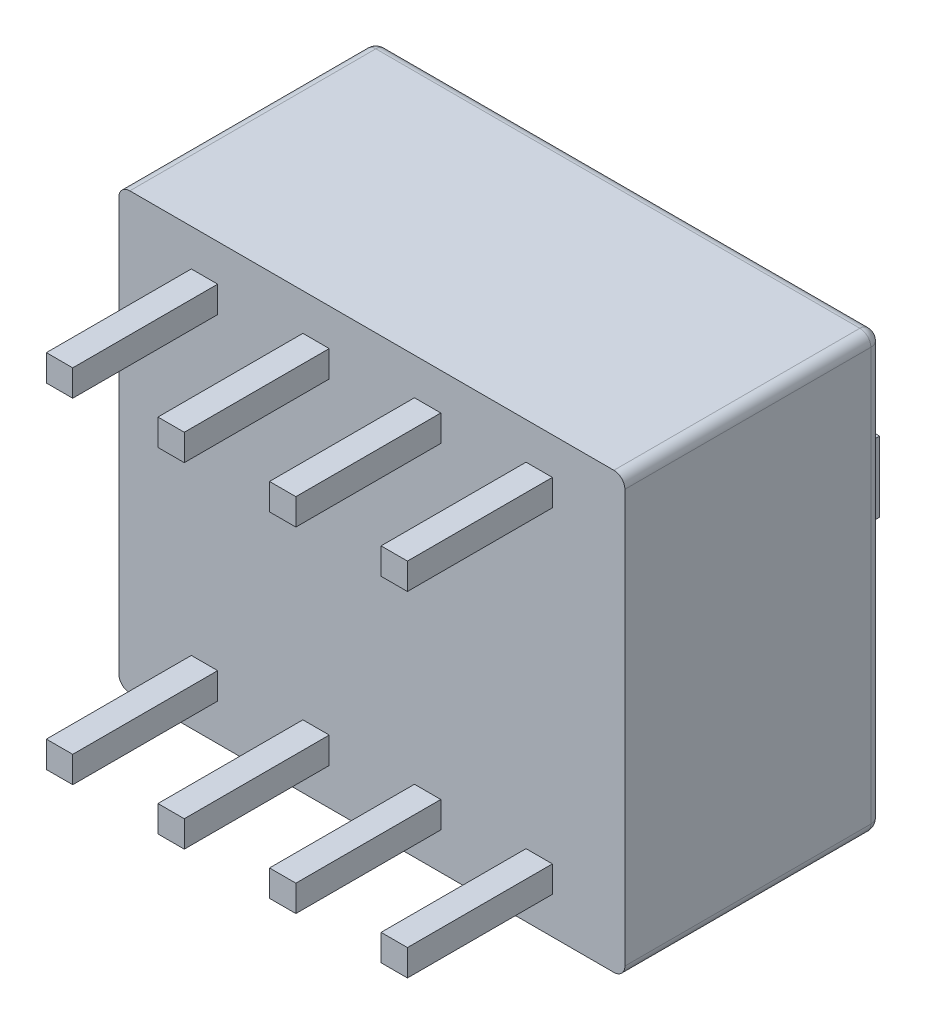
from build123d import *

# Parameters (mm, degrees)
IZIM1_W                       = 11.52
IZIM1_H                       = 9.9
Y_KSEKLIK_EKSTR_ZYON1_DEPTH   = 5.85
IZIM2_W                       = 1.4
IZIM2_H                       = 3.2
KES_EKSTR_ZYON1_DEPTH         = 1
IZIM4_W                       = 1.4
IZIM4_H                       = 1.6
Y_KSEKLIK_EKSTR_ZYON2_DEPTH   = 2.2
Y_KSEKLIK_EKSTR_ZYON2_2_DEPTH = 2.2
Y_KSEKLIK_EKSTR_ZYON2_3_DEPTH = 2.2
Y_KSEKLIK_EKSTR_ZYON2_4_DEPTH = 2.2
IZIM5_W                       = 1.4
IZIM5_H                       = 1.6
Y_KSEKLIK_EKSTR_ZYON3_DEPTH   = 0.9
Y_KSEKLIK_EKSTR_ZYON3_2_DEPTH = 0.9
Y_KSEKLIK_EKSTR_ZYON3_3_DEPTH = 0.9
Y_KSEKLIK_EKSTR_ZYON3_4_DEPTH = 0.9
RADYUS1_R                     = 0.25
IZIM6_W                       = 0.6
IZIM6_H                       = 0.6
Y_KSEKLIK_EKSTR_ZYON4_DEPTH   = 3.3


with BuildPart() as part:
    # Çizim1 → Yükseklik-Ekstrüzyon1 (new body)
    with BuildSketch(Plane.XY):
        Rectangle(IZIM1_W, IZIM1_H)
    extrude(amount=Y_KSEKLIK_EKSTR_ZYON1_DEPTH)

    # Çizim2 → Kes-Ekstrüzyon1 (cut)
    with BuildSketch(Plane(origin=(0, 0, 0), x_dir=(-1, 0, 0), z_dir=(0, 0, -1))):
        with Locations((3.81, 0)):
            Rectangle(IZIM2_W, IZIM2_H)
        with Locations((1.27, 0)):
            Rectangle(IZIM2_W, IZIM2_H)
        with Locations((-1.27, 0)):
            Rectangle(IZIM2_W, IZIM2_H)
        with Locations((-3.81, 0)):
            Rectangle(IZIM2_W, IZIM2_H)
    extrude(amount=-KES_EKSTR_ZYON1_DEPTH, mode=Mode.SUBTRACT)

    # Radyus1
    radyus1_edges = [part.edges().sort_by_distance(p)[0] for p in [
        (0, -4.95, 0),
        (-5.76, 0, 0),
        (0, 4.95, 0),
        (5.76, 0, 0),
        (5.76, -4.95, 2.925),
        (-5.76, -4.95, 2.925),
        (-5.76, 4.95, 2.925),
        (5.76, 4.95, 2.925),
    ]]
    fillet(radyus1_edges, radius=RADYUS1_R)

    # Çizim6 → Yükseklik-Ekstrüzyon4 (add)
    with BuildSketch(Plane.XY.offset(5.85)):
        with Locations((3.81, 3.81)):
            Rectangle(IZIM6_W, IZIM6_H)
        with Locations((1.27, 3.81)):
            Rectangle(IZIM6_W, IZIM6_H)
        with Locations((-1.27, 3.81)):
            Rectangle(IZIM6_W, IZIM6_H)
        with Locations((-3.81, 3.81)):
            Rectangle(IZIM6_W, IZIM6_H)
        with Locations((3.81, -3.81)):
            Rectangle(IZIM6_W, IZIM6_H)
        with Locations((1.27, -3.81)):
            Rectangle(IZIM6_W, IZIM6_H)
        with Locations((-1.27, -3.81)):
            Rectangle(IZIM6_W, IZIM6_H)
        with Locations((-3.81, -3.81)):
            Rectangle(IZIM6_W, IZIM6_H)
    extrude(amount=Y_KSEKLIK_EKSTR_ZYON4_DEPTH)


with BuildPart() as body_2:
    # Çizim4 → Yükseklik-Ekstrüzyon2 (new body)
    with BuildSketch(Plane(origin=(0, 0, 1), x_dir=(-1, 0, 0), z_dir=(0, 0, -1))):
        with Locations((3.81, 0.8)):
            Rectangle(IZIM4_W, IZIM4_H)
    extrude(amount=Y_KSEKLIK_EKSTR_ZYON2_DEPTH)


with BuildPart() as body_3:
    # Çizim4 → Y_kseklik-Ekstr_zyon2 2 (new body)
    with BuildSketch(Plane(origin=(0, 0, 1), x_dir=(-1, 0, 0), z_dir=(0, 0, -1))):
        with Locations((1.27, 0.8)):
            Rectangle(IZIM4_W, IZIM4_H)
    extrude(amount=Y_KSEKLIK_EKSTR_ZYON2_2_DEPTH)


with BuildPart() as body_4:
    # Çizim4 → Y_kseklik-Ekstr_zyon2 3 (new body)
    with BuildSketch(Plane(origin=(0, 0, 1), x_dir=(-1, 0, 0), z_dir=(0, 0, -1))):
        with Locations((-1.27, 0.8)):
            Rectangle(IZIM4_W, IZIM4_H)
    extrude(amount=Y_KSEKLIK_EKSTR_ZYON2_3_DEPTH)


with BuildPart() as body_5:
    # Çizim4 → Y_kseklik-Ekstr_zyon2 4 (new body)
    with BuildSketch(Plane(origin=(0, 0, 1), x_dir=(-1, 0, 0), z_dir=(0, 0, -1))):
        with Locations((-3.81, 0.8)):
            Rectangle(IZIM4_W, IZIM4_H)
    extrude(amount=Y_KSEKLIK_EKSTR_ZYON2_4_DEPTH)


with BuildPart() as body_6:
    # Çizim5 → Yükseklik-Ekstrüzyon3 (new body)
    with BuildSketch(Plane(origin=(0, 0, 1), x_dir=(-1, 0, 0), z_dir=(0, 0, -1))):
        with Locations((-3.81, -0.8)):
            Rectangle(IZIM5_W, IZIM5_H)
    extrude(amount=Y_KSEKLIK_EKSTR_ZYON3_DEPTH)


with BuildPart() as body_7:
    # Çizim5 → Y_kseklik-Ekstr_zyon3 2 (new body)
    with BuildSketch(Plane(origin=(0, 0, 1), x_dir=(-1, 0, 0), z_dir=(0, 0, -1))):
        with Locations((-1.27, -0.8)):
            Rectangle(IZIM5_W, IZIM5_H)
    extrude(amount=Y_KSEKLIK_EKSTR_ZYON3_2_DEPTH)


with BuildPart() as body_8:
    # Çizim5 → Y_kseklik-Ekstr_zyon3 3 (new body)
    with BuildSketch(Plane(origin=(0, 0, 1), x_dir=(-1, 0, 0), z_dir=(0, 0, -1))):
        with Locations((1.27, -0.8)):
            Rectangle(IZIM5_W, IZIM5_H)
    extrude(amount=Y_KSEKLIK_EKSTR_ZYON3_3_DEPTH)


with BuildPart() as body_9:
    # Çizim5 → Y_kseklik-Ekstr_zyon3 4 (new body)
    with BuildSketch(Plane(origin=(0, 0, 1), x_dir=(-1, 0, 0), z_dir=(0, 0, -1))):
        with Locations((3.81, -0.8)):
            Rectangle(IZIM5_W, IZIM5_H)
    extrude(amount=Y_KSEKLIK_EKSTR_ZYON3_4_DEPTH)


solid = Compound([part.part, body_2.part, body_3.part, body_4.part, body_5.part, body_6.part, body_7.part, body_8.part, body_9.part])
